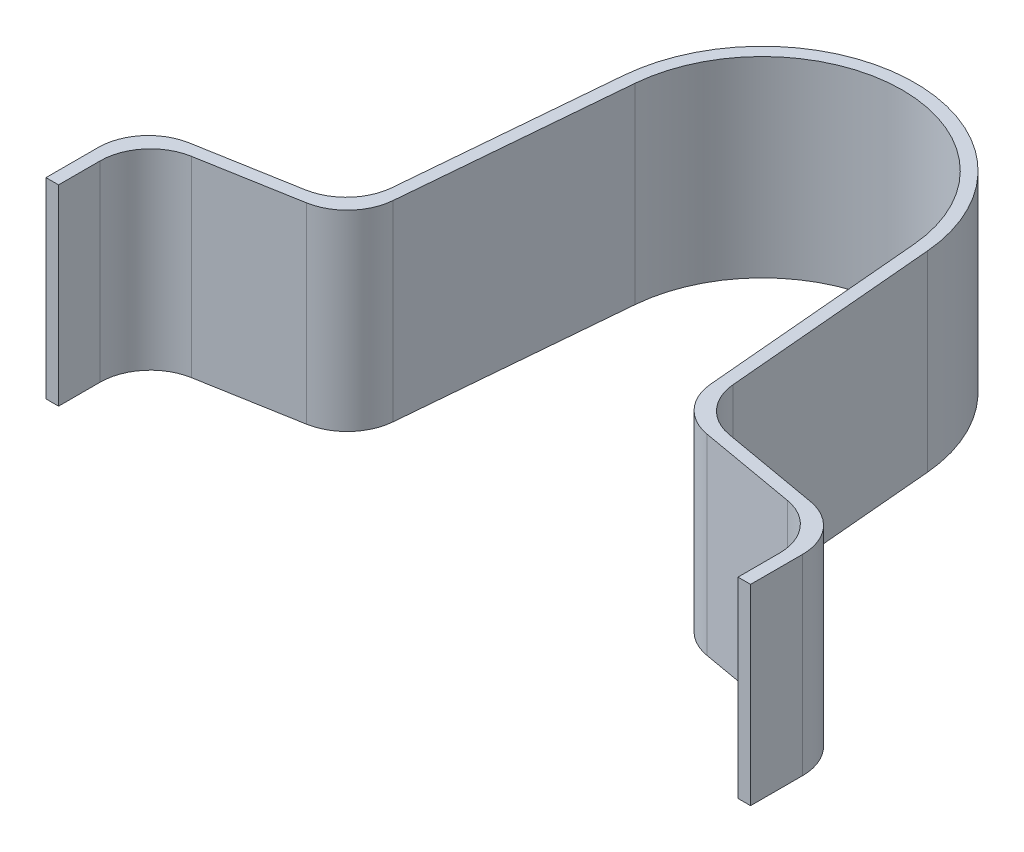
from build123d import *

# Parameters (mm, degrees)
BOSS_EXTRUDE2_DEPTH = 30.48
BOSS_EXTRUDE3_DEPTH = 30.48
CUT_EXTRUDE2_DEPTH  = 87.125730482
FILLET1_R           = 8


with BuildPart() as part:
    # Sketch1 → Boss-Extrude2 (new body)
    with BuildSketch(Plane(origin=(0, 0, 0), x_dir=(1, 0, 0), z_dir=(0, 1, 0))):
        with BuildLine():
            ThreePointArc((-22.169540289, 1.937007843), (0, 22.254), (22.169540289, 1.937007843))
            Line((22.169540289, 1.937007843), (27.396679476, -57.888910388))
            Line((27.396679476, -57.888910388), (29.404298913, -57.888910388))
            Line((29.404298913, -57.888910388), (24.161949769, 2.111089612))
            ThreePointArc((24.161949769, 2.111089612), (0, 24.254), (-24.161949769, 2.111089612))
            Line((-24.161949769, 2.111089612), (-29.404298913, -57.888910388))
            Line((-29.404298913, -57.888910388), (-27.396679476, -57.888910388))
            Line((-27.396679476, -57.888910388), (-22.169540289, 1.937007843))
        make_face()
    extrude(amount=BOSS_EXTRUDE2_DEPTH)

    # Sketch2 → Boss-Extrude3 (add)
    with BuildSketch(Plane(origin=(0, 30.48, 0), x_dir=(1, 0, 0), z_dir=(0, 1, 0))):
        Polygon((-27.656849199, -37.888910388), (-56.013258297, -42.888910388), (-56.013258297, -57.888910388), (-54.013258297, -57.888910388), (-54.013258297, -44.567109651), (-27.837066341, -39.951540757), align=None)
        Polygon((54.013258297, -44.567109651), (27.837066341, -39.951540757), (27.656849199, -37.888910388), (56.013258297, -42.888910388), (56.013258297, -57.888910388), (54.013258297, -57.888910388), align=None)
    extrude(amount=-BOSS_EXTRUDE3_DEPTH)

    # Sketch5 → Cut-Extrude2 (cut, through all)
    with BuildSketch(Plane(origin=(0, 30.48, 0), x_dir=(1, 0, 0), z_dir=(0, 1, 0))):
        Polygon((0, -35.043114897), (-25.798033303, -39.592004218), (-27.396679476, -57.888910388), (27.396679476, -57.888910388), (25.798033303, -39.592004218), align=None)
        Polygon((-25.798033303, -39.592004218), (-27.837066341, -39.951540757), (-29.404298913, -57.888910388), (-27.396679476, -57.888910388), align=None)
        Polygon((27.837066341, -39.951540757), (25.798033303, -39.592004218), (27.396679476, -57.888910388), (29.404298913, -57.888910388), align=None)
    extrude(amount=-CUT_EXTRUDE2_DEPTH, mode=Mode.SUBTRACT)

    # Fillet1
    fillet1_edges = [part.edges().sort_by_distance(p)[0] for p in [
        (-27.656849199, 15.24, 37.888910388),
        (-54.013258297, 15.24, 44.567109651),
        (-56.013258297, 15.24, 42.888910388),
        (54.013258297, 15.24, 44.567109651),
        (27.656849199, 15.24, 37.888910388),
        (56.013258297, 15.24, 42.888910388),
        (-25.798033303, 15.24, 39.592004218),
        (25.798033303, 15.24, 39.592004218),
    ]]
    fillet(fillet1_edges, radius=FILLET1_R)


solid = part.part
